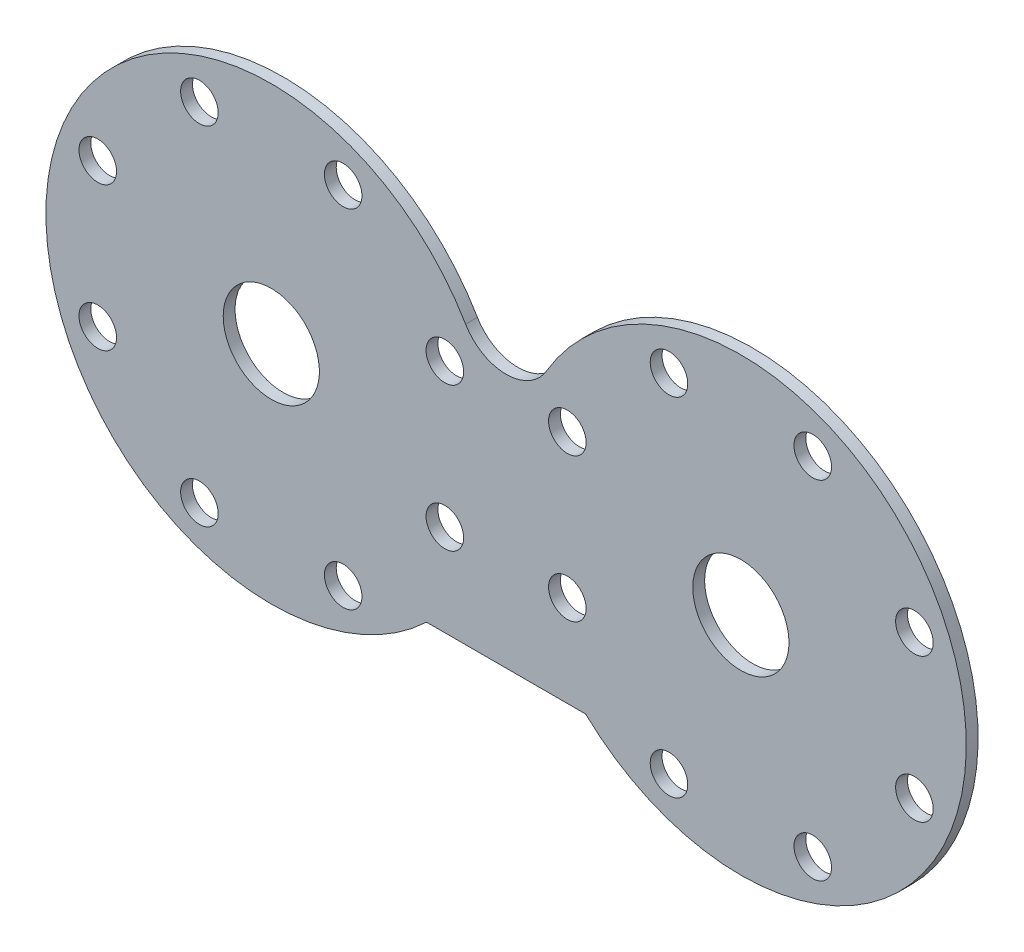
from build123d import *

# Parameters (mm, degrees)
SKETCH1_R           = 3.2512
SKETCH1_R_2         = 1.27
BOSS_EXTRUDE1_DEPTH = 0.800000051


with BuildPart() as part:
    # Sketch1 → Boss-Extrude1 (new body)
    with BuildSketch(Plane.XY):
        with BuildLine():
            ThreePointArc((21.253467287, -26.289), (46.841342124, -13.11656107), (18.612068966, -7.516505446))
            ThreePointArc((18.612068966, -7.516505446), (15.875, -9.08244408), (13.137931034, -7.516505446))
            ThreePointArc((13.137931034, -7.516505446), (-15.091342124, -13.11656107), (10.496532713, -26.289))
            Line((10.496532713, -26.289), (21.253467287, -26.289))
        make_face()
        with Locations(Location((31.75, -15.24, 0), (0, 0, 180))):
            Circle(SKETCH1_R, mode=Mode.SUBTRACT)
        with Locations(Location((0, -15.24, 0), (0, 0, 180))):
            Circle(SKETCH1_R, mode=Mode.SUBTRACT)
        with Locations(Location((-11.733270063, -10.379920409, 0), (0, 0, 180))):
            Circle(SKETCH1_R_2, mode=Mode.SUBTRACT)
        with Locations(Location((11.733270063, -10.379920409, 0), (0, 0, 180))):
            Circle(SKETCH1_R_2, mode=Mode.SUBTRACT)
        with Locations(Location((-4.860079591, -3.506729937, 0), (0, 0, 180))):
            Circle(SKETCH1_R_2, mode=Mode.SUBTRACT)
        with Locations(Location((4.860079591, -3.506729937, 0), (0, 0, 180))):
            Circle(SKETCH1_R_2, mode=Mode.SUBTRACT)
        with Locations(Location((20.016729937, -10.379920409, 0), (0, 0, 180))):
            Circle(SKETCH1_R_2, mode=Mode.SUBTRACT)
        with Locations(Location((43.483270063, -10.379920409, 0), (0, 0, 180))):
            Circle(SKETCH1_R_2, mode=Mode.SUBTRACT)
        with Locations(Location((26.889920409, -3.506729937, 0), (0, 0, 180))):
            Circle(SKETCH1_R_2, mode=Mode.SUBTRACT)
        with Locations(Location((36.610079591, -3.506729937, 0), (0, 0, 180))):
            Circle(SKETCH1_R_2, mode=Mode.SUBTRACT)
        with Locations(Location((36.610079591, -26.973270063, 0), (0, 0, 180))):
            Circle(SKETCH1_R_2, mode=Mode.SUBTRACT)
        with Locations(Location((20.016729937, -20.100079591, 0), (0, 0, 180))):
            Circle(SKETCH1_R_2, mode=Mode.SUBTRACT)
        with Locations(Location((43.483270063, -20.100079591, 0), (0, 0, 180))):
            Circle(SKETCH1_R_2, mode=Mode.SUBTRACT)
        with Locations(Location((-4.860079591, -26.973270063, 0), (0, 0, 180))):
            Circle(SKETCH1_R_2, mode=Mode.SUBTRACT)
        with Locations(Location((4.860079591, -26.973270063, 0), (0, 0, 180))):
            Circle(SKETCH1_R_2, mode=Mode.SUBTRACT)
        with Locations(Location((-11.733270063, -20.100079591, 0), (0, 0, 180))):
            Circle(SKETCH1_R_2, mode=Mode.SUBTRACT)
        with Locations(Location((11.733270063, -20.100079591, 0), (0, 0, 180))):
            Circle(SKETCH1_R_2, mode=Mode.SUBTRACT)
        with Locations(Location((26.889920409, -26.973270063, 0), (0, 0, 180))):
            Circle(SKETCH1_R_2, mode=Mode.SUBTRACT)
    extrude(amount=BOSS_EXTRUDE1_DEPTH)


solid = part.part
